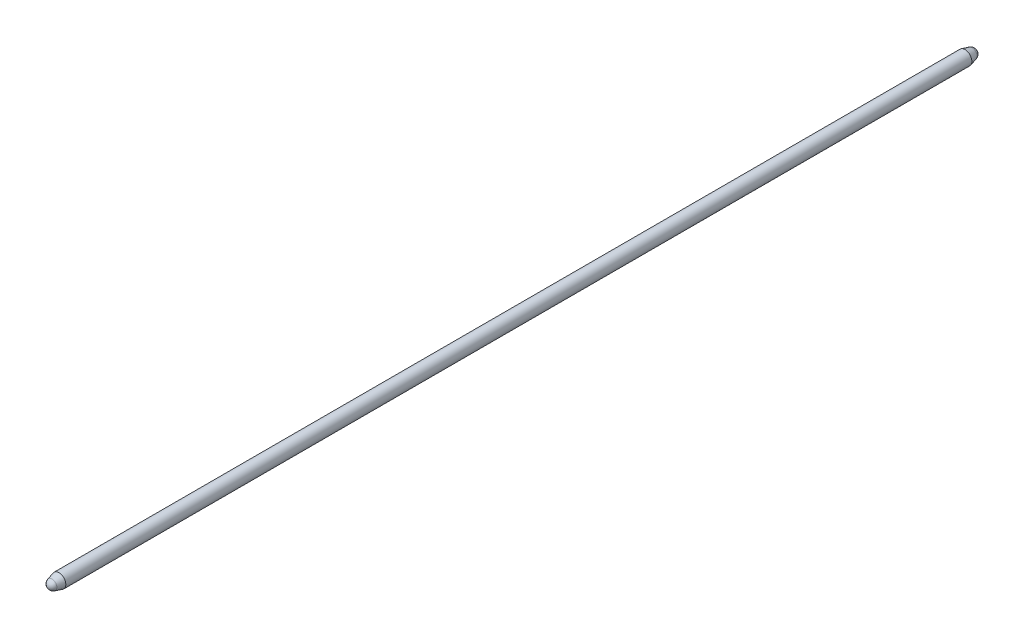
from build123d import *


with BuildPart() as part:
    # Sketch2 → Revolve1 (revolve)
    with BuildSketch(Plane(origin=(0, 0, 0), x_dir=(0, 0, -1), z_dir=(1, 0, 0))):
        with BuildLine():
            Line((1677.838872597, 25.4), (1703.959917956, 18.400886991))
            ThreePointArc((1703.959917956, 18.400886991), (1714.142796279, 11.596905223), (1718.079415146, 0))
            Line((1718.079415146, 0), (1677.838872597, 0))
            Line((1677.838872597, 0), (1677.838872597, 22.987))
            Line((1677.838872597, 22.987), (0, 22.987))
            Line((0, 22.987), (-1677.838872597, 22.987))
            Line((-1677.838872597, 22.987), (-1677.838872597, 0))
            Line((-1677.838872597, 0), (-1718.079415146, 0))
            ThreePointArc((-1718.079415146, 0), (-1714.142796279, 11.596905223), (-1703.959917956, 18.400886991))
            Line((-1703.959917956, 18.400886991), (-1677.838872597, 25.4))
            Line((-1677.838872597, 25.4), (1677.838872597, 25.4))
        make_face()
    revolve(axis=Axis((0, 0, -1718.079415146), (0, 0, 1)))


solid = part.part
